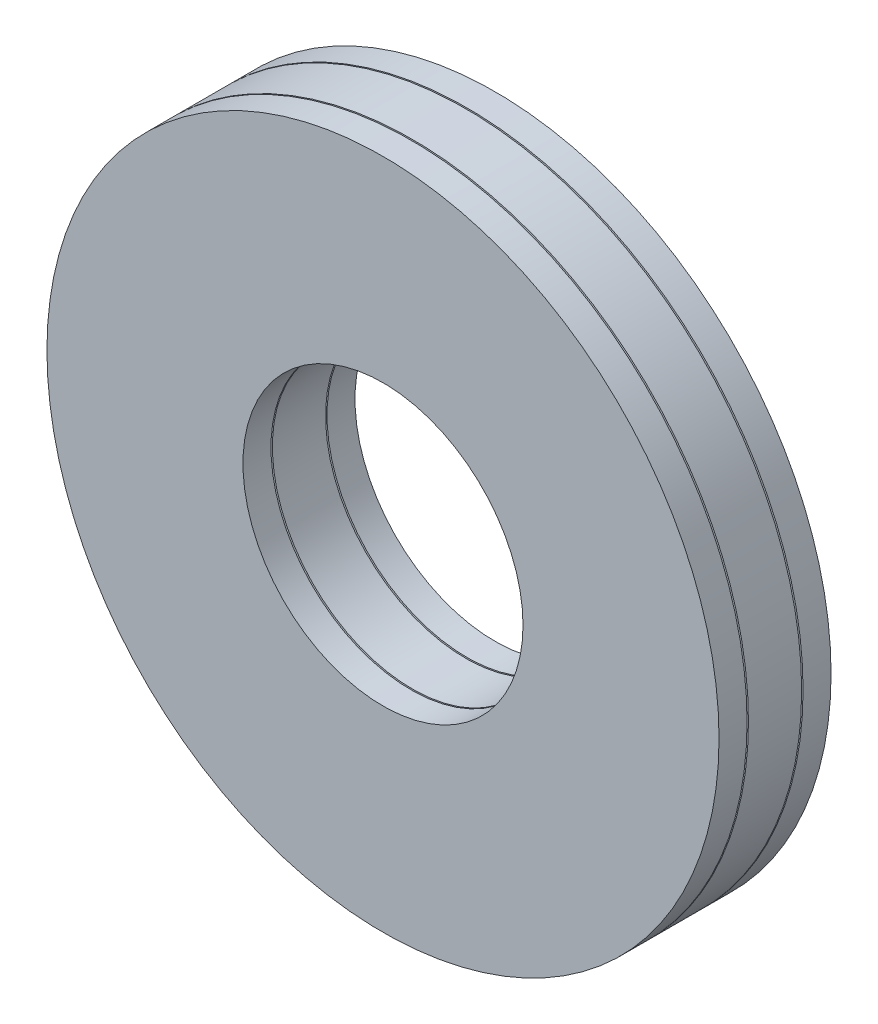
from build123d import *


with BuildPart() as part:
    # 草图2 → 旋转1 (revolve)
    with BuildSketch(Plane(origin=(0, 0, 0), x_dir=(0, 0, -1), z_dir=(1, 0, 0)), mode=Mode.PRIVATE) as revolve_1_sk:
        Polygon((1, 12), (2, 12), (2, 5), (1, 5), (1, 6), (0.95, 6), (0.95, 5), (-0.95, 5), (-0.95, 6), (-1, 6), (-1, 5), (-2, 5), (-2, 12), (-1, 12), (-1, 11.5), (-0.95, 11.5), (-0.95, 12), (0.95, 12), (0.95, 11.5), (1, 11.5), align=None)
    revolve(revolve_1_sk.sketch.rotate(Axis((0, 0, 2), (0, 0, -1)), 90), axis=Axis((0, 0, 2), (0, 0, -1)))


solid = part.part
